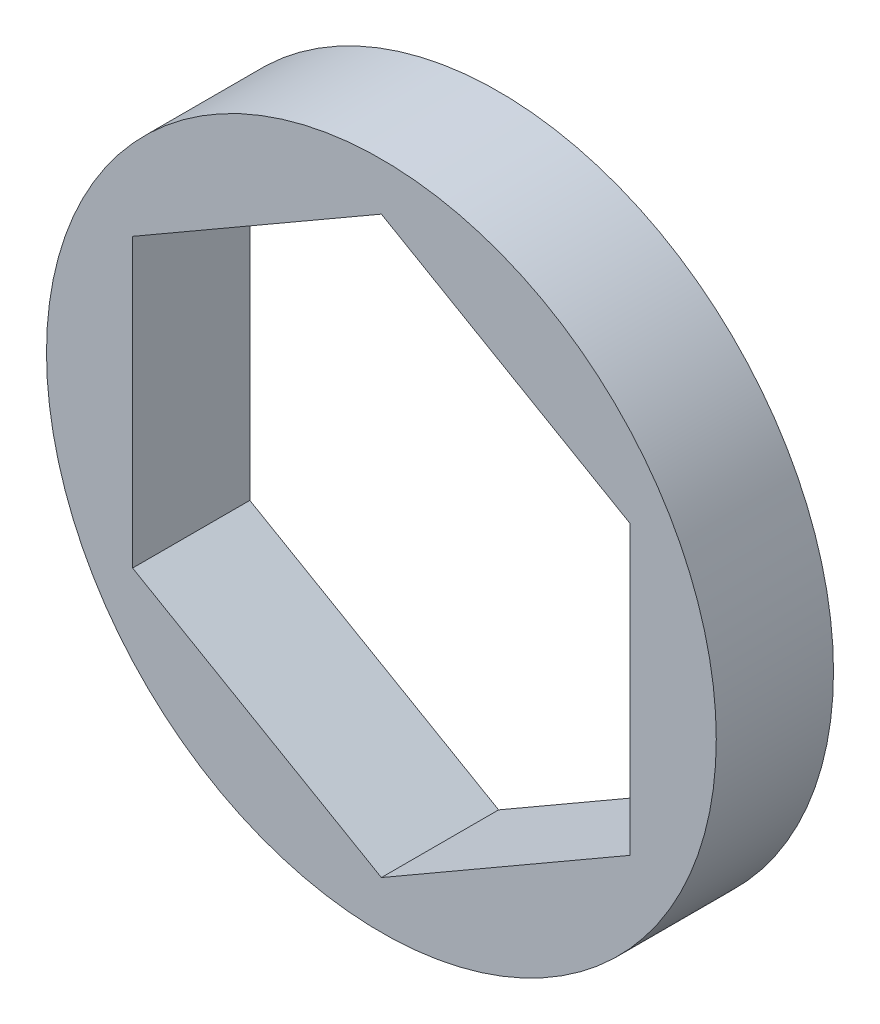
from build123d import *

# Parameters (mm, degrees)
SKETCH1_R           = 8.89
BOSS_EXTRUDE1_DEPTH = 1.55575


with BuildPart() as part:
    # Sketch1 → Boss-Extrude1 (new, symmetric)
    with BuildSketch(Plane.XY):
        Circle(SKETCH1_R)
        Polygon((0, 7.625642355), (-6.604, 3.812821178), (-6.604, -3.812821178), (0, -7.625642355), (6.604, -3.812821178), (6.604, 3.812821178), align=None, mode=Mode.SUBTRACT)
    extrude(amount=BOSS_EXTRUDE1_DEPTH, both=True)


solid = part.part
